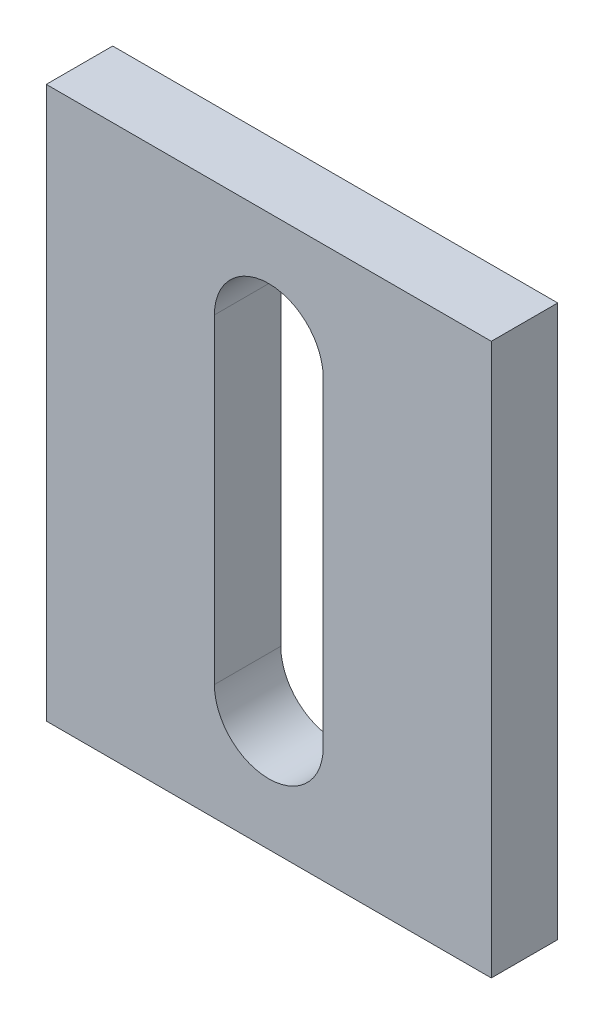
from build123d import *

# Parameters (mm, degrees)
SKETCH_1_W      = 28.812419505
SKETCH_1_H      = 35.7
EXTRUDE_1_DEPTH = 4.3


with BuildPart() as part:
    # 草图1 → 凸台-拉伸1 (new body)
    with BuildSketch(Plane.XY):
        with Locations((17.406209753, -17.85)):
            Rectangle(SKETCH_1_W, SKETCH_1_H)
        with BuildLine():
            ThreePointArc((13.884047379, -28.212407831), (17.406209752, -31.734570205), (20.928372126, -28.212407831))
            Line((20.928372126, -28.212407831), (20.928372126, -7.487592169))
            ThreePointArc((20.928372126, -7.487592169), (17.406209752, -3.965429795), (13.884047379, -7.487592169))
            Line((13.884047379, -7.487592169), (13.884047379, -28.212407831))
        make_face(mode=Mode.SUBTRACT)
    extrude(amount=EXTRUDE_1_DEPTH)


solid = part.part
